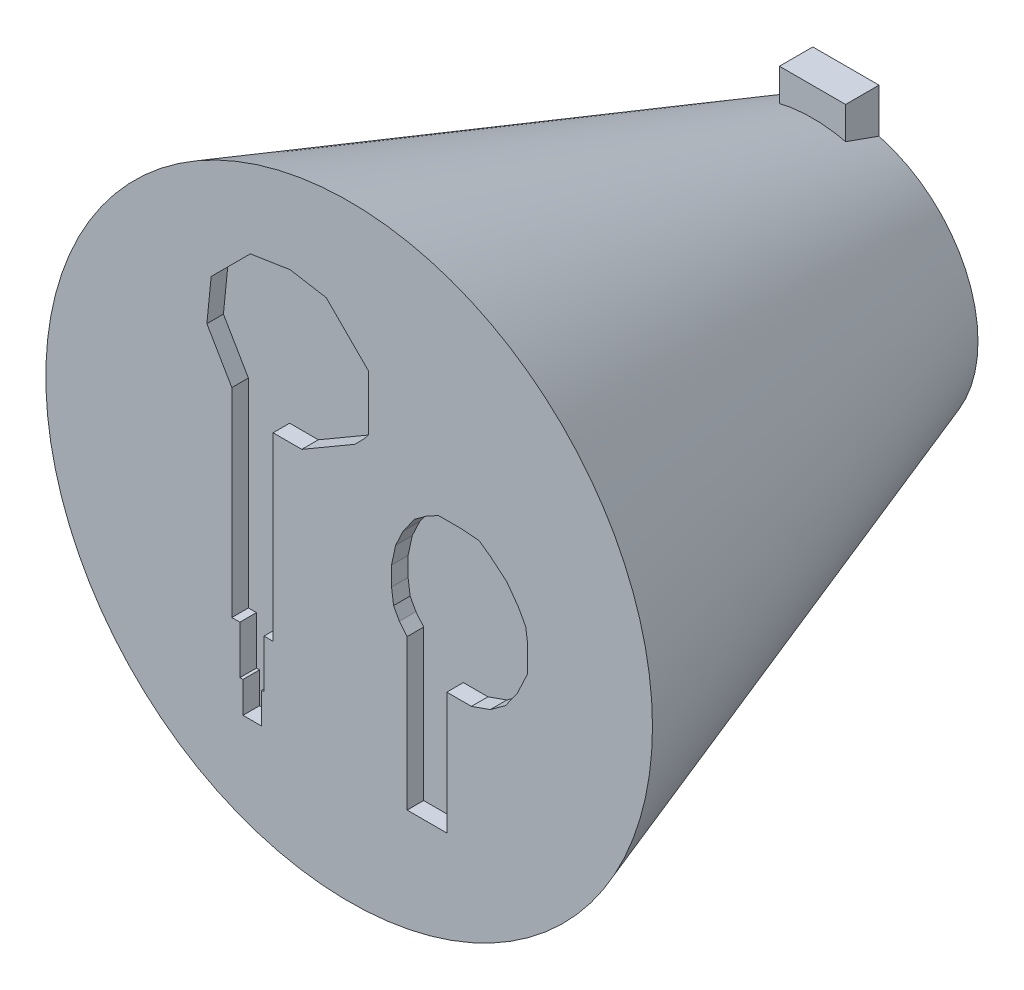
from build123d import *

# Parameters (mm, degrees)
ESQUISSE1_R             = 4
BOSS_EXTRU_1_DEPTH      = 15
BOSS_EXTRU_1_DRAFT      = -19
BOSS_EXTRU_2_DEPTH      = 0.01
BOSS_EXTRU_2_DEPTH_BACK = 1
ESQUISSE2_W             = 2
ESQUISSE2_H             = 5.2
ENL_V_MAT_EXTRU_2_DEPTH = 0.5


with BuildPart() as part:
    # Esquisse1 → Boss.-Extru.1 (with draft: the straight prism first)
    with BuildSketch(Plane.XY):
        with Locations((-45.645547355, 34.788865837)):
            Circle(ESQUISSE1_R)
    extrude(amount=BOSS_EXTRU_1_DEPTH)
    # Boss.-Extru.1: the draft: its side faces are tilted about the plane it starts from
    boss_extru_1_sides = [part.faces().sort_by_distance(p)[0] for p in [
        (-49.645547355, 34.788865837, 7.5),
    ]]
    draft(boss_extru_1_sides, Plane.XY, BOSS_EXTRU_1_DRAFT)

    # Esquisse4 → Enlèv. mat.-Extru.2 (cut)
    with BuildSketch(Plane.XY.offset(15)):
        Polygon((-49.943995821, 38.603153257), (-49.189604531, 37.307830652), (-49.189604531, 31.291720416), (-48.946969311, 31.291720416), (-48.946969311, 29.839834395), (-48.853477913, 29.839834395), (-48.853477913, 28.901020834), (-48.286038565, 28.901020834), (-48.286038565, 29.839834395), (-48.218416226, 29.839834395), (-48.218416226, 31.291720416), (-47.943149859, 31.291720416), (-47.943149859, 36.748991058), (-47.075851086, 36.748991058), (-45.477923282, 37.679618542), (-45.202049869, 37.955491955), (-45.061274623, 38.130390425), (-45.061274623, 39.80899134), (-46.339472035, 41.087188751), (-47.432529213, 41.272727647), (-48.630268638, 41.087188751), (-49.814003652, 39.903453737), align=None)
        Polygon((-42.696072341, 28.901020834), (-42.696072341, 32.586123938), (-41.951495344, 32.586123938), (-41.37816481, 32.790044364), (-40.922152429, 33.120204937), (-40.565248273, 33.620161984), (-40.261777364, 34.268608239), (-40.261777364, 35.135148566), (-40.310005521, 35.488432157), (-40.530692657, 35.894061573), (-40.887092257, 36.386314868), (-41.37816481, 36.796394376), (-41.723349738, 37.042811415), (-42.282245323, 37.081943025), (-42.945535048, 37.081943025), (-43.307086562, 36.885236956), (-43.669608606, 36.622764946), (-44.014105478, 36.140188221), (-44.240513356, 35.656407614), (-44.364881332, 35.076877066), (-44.364881332, 34.5020846), (-44.302697344, 34.04657098), (-44.127309417, 33.724202835), (-43.893548402, 33.440965737), (-43.893548402, 28.901020834), align=None)
    extrude(amount=-ENL_V_MAT_EXTRU_2_DEPTH, mode=Mode.SUBTRACT)


with BuildPart() as body_2:
    # Esquisse2 → Boss.-Extru.2 (new, two sides: drawn at the far end of the back side and taken through both)
    with BuildSketch(Plane(origin=(0, 0, 0), x_dir=(-1, 0, 0), z_dir=(0, 0, -1)).offset(-BOSS_EXTRU_2_DEPTH_BACK)):
        with Locations((45.645547355, 37.388865837)):
            Rectangle(ESQUISSE2_W, ESQUISSE2_H)
    extrude(amount=BOSS_EXTRU_2_DEPTH + BOSS_EXTRU_2_DEPTH_BACK)


solid = Compound([part.part, body_2.part])
